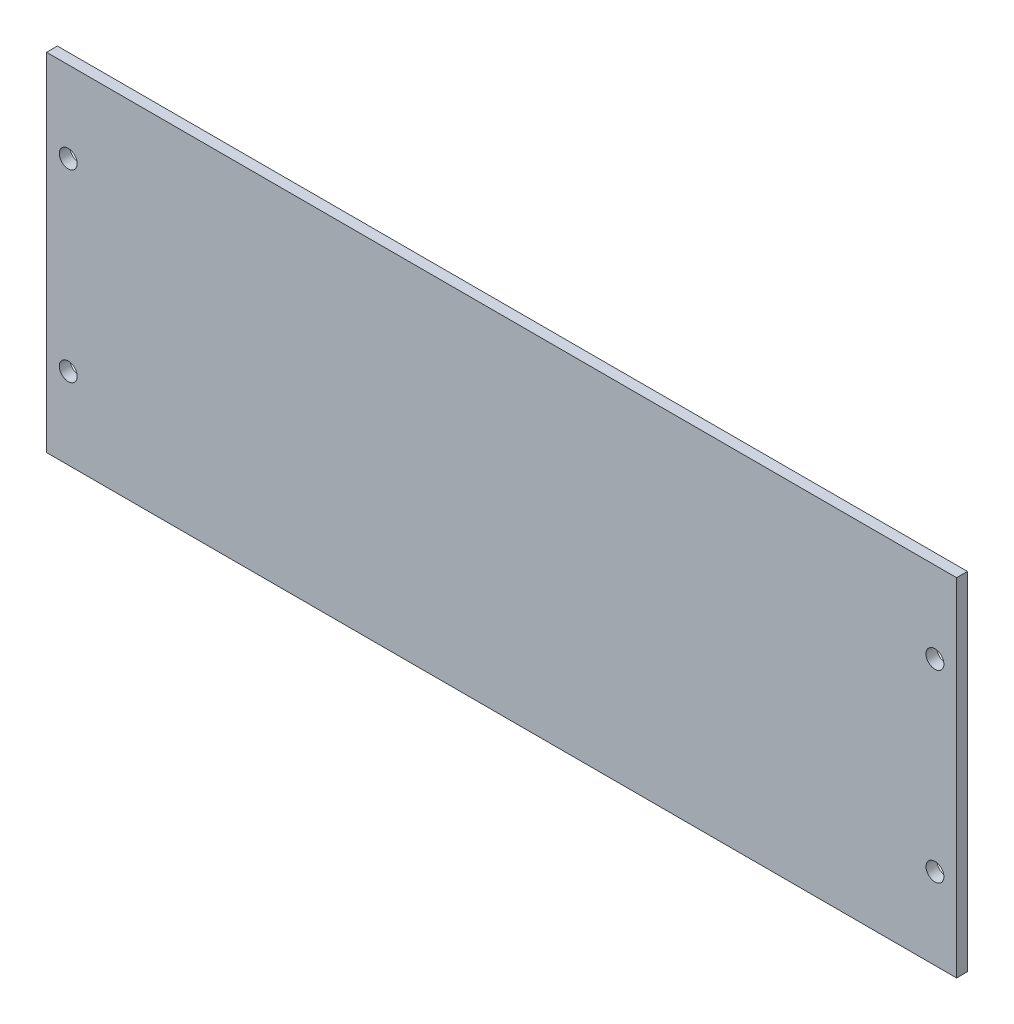
from build123d import *

# Parameters (mm, degrees)
ESQUISSE1_W        = 336
ESQUISSE1_H        = 128
BOSS_EXTRU_1_DEPTH = 4
D_GAGEMENT_M61_D   = 6.6


with BuildPart() as part:
    # Esquisse1 → Boss.-Extru.1 (new body)
    with BuildSketch(Plane.XY):
        Rectangle(ESQUISSE1_W, ESQUISSE1_H)
    extrude(amount=BOSS_EXTRU_1_DEPTH)

    # Dégagement M61 (through all)
    with Locations(Plane(origin=(-160, 34, 0), x_dir=(-1, 0, 0), z_dir=(0, 0, -1))):
        with Locations((0, 0), (0, -68), (-320, -68), (-320, 0)):
            Hole(D_GAGEMENT_M61_D / 2)


solid = part.part
